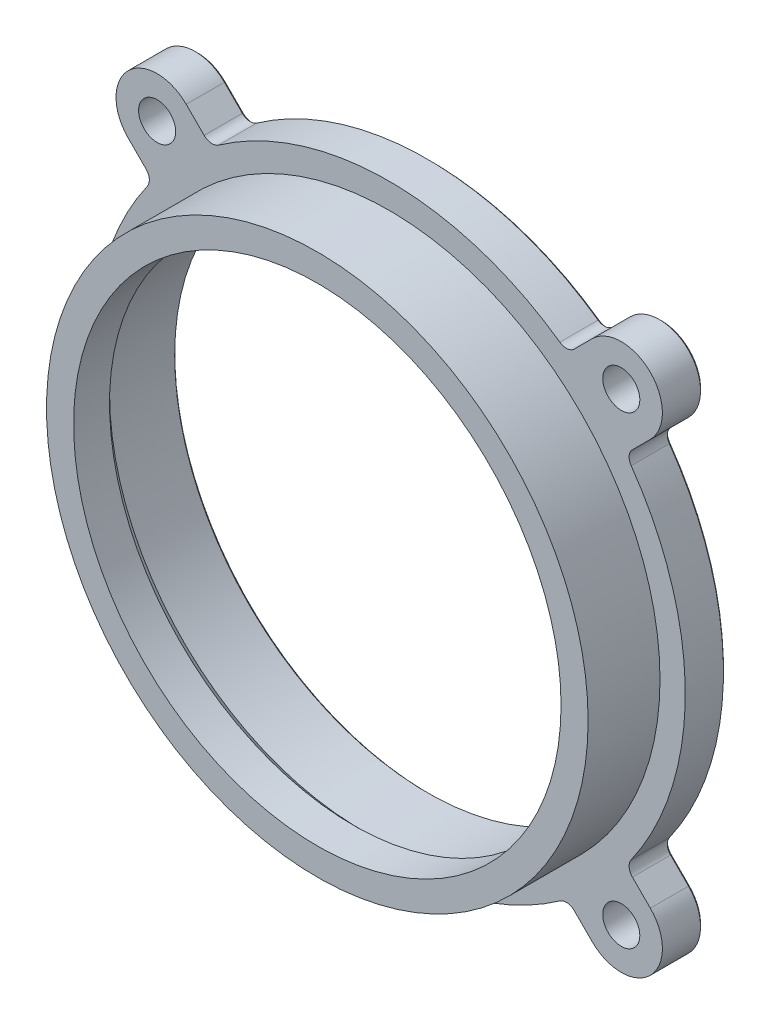
from build123d import *

# Parameters (mm, degrees)
SKETCH1_R           = 1.65
SKETCH1_R_2         = 21.6
BOSS_EXTRUDE1_DEPTH = 3.6
SKETCH4_R           = 24.11
SKETCH4_R_2         = 21.7
BOSS_EXTRUDE2_DEPTH = 6.4
CHAMFER1_SIZE       = 0.2


with BuildPart() as part:
    # Sketch1 → Boss-Extrude1 (new body)
    with BuildSketch(Plane.XY):
        with BuildLine():
            Line((23.249670965, 18.073649327), (21.651772253, 16.475750615))
            ThreePointArc((21.651772253, 16.475750615), (21.3625386, 15.854117448), (21.541668543, 15.192304512))
            ThreePointArc((21.541668543, 15.192304512), (26.36, 0), (21.541668543, -15.192304512))
            ThreePointArc((21.541668543, -15.192304512), (21.3625386, -15.854117448), (21.651772253, -16.475750615))
            Line((21.651772253, -16.475750615), (23.249670965, -18.073649327))
            ThreePointArc((23.249670965, -18.073649327), (23.249670965, -23.249670965), (18.073649327, -23.249670965))
            Line((18.073649327, -23.249670965), (16.475750615, -21.651772253))
            ThreePointArc((16.475750615, -21.651772253), (15.854117448, -21.3625386), (15.192304512, -21.541668543))
            ThreePointArc((15.192304512, -21.541668543), (0, -26.36), (-15.192304512, -21.541668543))
            ThreePointArc((-15.192304512, -21.541668543), (-15.854117448, -21.3625386), (-16.475750615, -21.651772253))
            Line((-16.475750615, -21.651772253), (-18.073649327, -23.249670965))
            ThreePointArc((-18.073649327, -23.249670965), (-23.249670965, -23.249670965), (-23.249670965, -18.073649327))
            Line((-23.249670965, -18.073649327), (-21.651772253, -16.475750615))
            ThreePointArc((-21.651772253, -16.475750615), (-21.3625386, -15.854117448), (-21.541668543, -15.192304512))
            ThreePointArc((-21.541668543, -15.192304512), (-26.36, 0), (-21.541668543, 15.192304512))
            ThreePointArc((-21.541668543, 15.192304512), (-21.3625386, 15.854117448), (-21.651772253, 16.475750615))
            Line((-21.651772253, 16.475750615), (-23.249670965, 18.073649327))
            ThreePointArc((-23.249670965, 18.073649327), (-23.249670965, 23.249670965), (-18.073649327, 23.249670965))
            Line((-18.073649327, 23.249670965), (-16.475750615, 21.651772253))
            ThreePointArc((-16.475750615, 21.651772253), (-15.854117448, 21.3625386), (-15.192304512, 21.541668543))
            ThreePointArc((-15.192304512, 21.541668543), (0, 26.36), (15.192304512, 21.541668543))
            ThreePointArc((15.192304512, 21.541668543), (15.854117448, 21.3625386), (16.475750615, 21.651772253))
            Line((16.475750615, 21.651772253), (18.073649327, 23.249670965))
            ThreePointArc((18.073649327, 23.249670965), (23.249670965, 23.249670965), (23.249670965, 18.073649327))
        make_face()
        with Locations((-20.661660146, -20.661660146)):
            Circle(SKETCH1_R, mode=Mode.SUBTRACT)
        with Locations((20.661660146, -20.661660146)):
            Circle(SKETCH1_R, mode=Mode.SUBTRACT)
        Circle(SKETCH1_R_2, mode=Mode.SUBTRACT)
        with Locations(Location((20.661660146, 20.661660146, 0), (0, 0, 180))):
            Circle(SKETCH1_R, mode=Mode.SUBTRACT)
        with Locations(Location((-20.661660146, 20.661660146, 0), (0, 0, 180))):
            Circle(SKETCH1_R, mode=Mode.SUBTRACT)
    extrude(amount=BOSS_EXTRUDE1_DEPTH)

    # Sketch4 → Boss-Extrude2 (add)
    with BuildSketch(Plane.XY.offset(3.6)):
        Circle(SKETCH4_R)
        Circle(SKETCH4_R_2, mode=Mode.SUBTRACT)
    extrude(amount=BOSS_EXTRUDE2_DEPTH)

    # Sketch7 → Cut-Revolve1 (revolve, cut)
    with BuildSketch(Plane(origin=(0, 0, 0), x_dir=(1, 0, 0), z_dir=(0, 1, 0))):
        Polygon((0, -10), (0, 0), (22.5, 0), (22.5, -6), (21.7, -6.8), (21.7, -10), align=None)
    revolve(axis=Axis((0, 0, 10), (0, 0, -1)), mode=Mode.SUBTRACT)

    # Chamfer1
    chamfer1_edges = [part.edges().sort_by_distance(p)[0] for p in [
        (17.274699971, -22.450721609, 0),
        (15.854117448, -21.3625386, 0),
        (0, -26.36, 0),
        (-15.854117448, -21.3625386, 0),
        (-17.274699971, -22.450721609, 0),
        (-23.249670965, -23.249670965, 0),
        (-22.450721609, -17.274699971, 0),
        (-21.3625386, -15.854117448, 0),
        (-26.36, 0, 0),
        (-21.3625386, 15.854117448, 0),
        (-22.450721609, 17.274699971, 0),
        (-23.249670965, 23.249670965, 0),
        (-17.274699971, 22.450721609, 0),
        (-15.854117448, 21.3625386, 0),
        (0, 26.36, 0),
        (15.854117448, 21.3625386, 0),
        (17.274699971, 22.450721609, 0),
        (23.249670965, 23.249670965, 0),
        (22.450721609, 17.274699971, 0),
        (21.3625386, 15.854117448, 0),
        (26.36, 0, 0),
        (21.3625386, -15.854117448, 0),
        (22.450721609, -17.274699971, 0),
        (23.249670965, -23.249670965, 0),
        (-22.311660146, -20.661660146, 0),
        (19.011660146, -20.661660146, 0),
        (22.311660146, 20.661660146, 0),
        (-19.011660146, 20.661660146, 0),
        (-22.5, 0, 0),
    ]]
    chamfer(chamfer1_edges, length=CHAMFER1_SIZE)


solid = part.part
